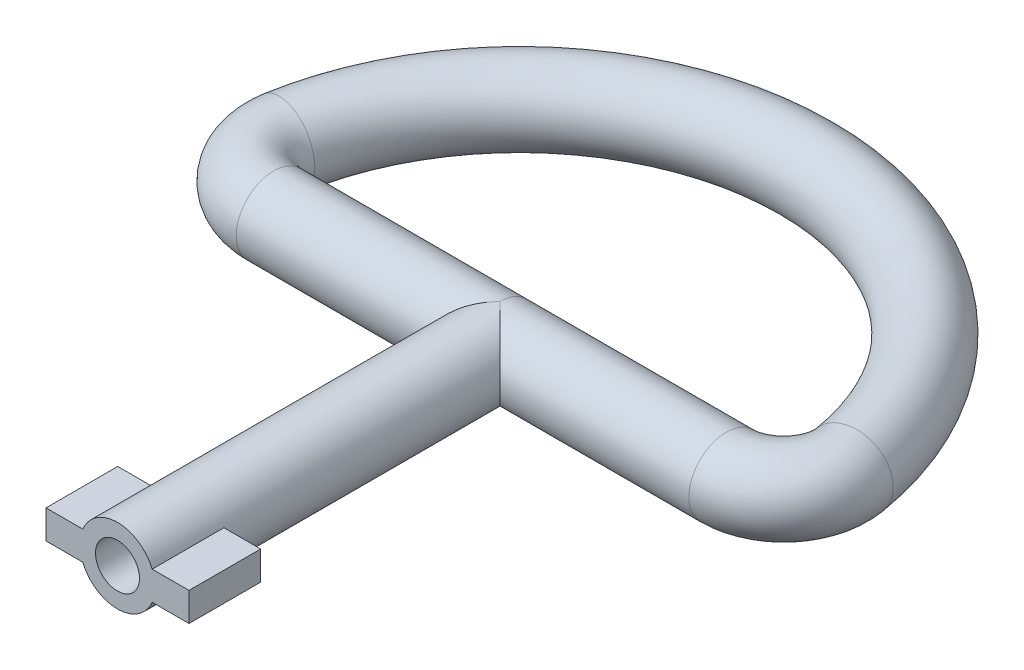
from build123d import *

# Parameters (mm, degrees)
CROQUIS1_R              = 2.3
SALIENTE_EXTRUIR1_DEPTH = 7.5
CROQUIS4_R              = 3.925
SALIENTE_EXTRUIR3_DEPTH = 32.5
CROQUIS5_R              = 3.925


with BuildPart() as part:
    # Croquis1 → Saliente-Extruir1 (new body)
    with BuildSketch(Plane.XY):
        with BuildLine():
            Line((3.627068375, 1.5), (7.475, 1.5))
            Line((7.475, 1.5), (7.475, -1.5))
            Line((7.475, -1.5), (3.627068375, -1.5))
            ThreePointArc((3.627068375, -1.5), (0, -3.925), (-3.627068375, -1.5))
            Line((-3.627068375, -1.5), (-7.475, -1.5))
            Line((-7.475, -1.5), (-7.475, 1.5))
            Line((-7.475, 1.5), (-3.627068375, 1.5))
            ThreePointArc((-3.627068375, 1.5), (0, 3.925), (3.627068375, 1.5))
        make_face()
        Circle(CROQUIS1_R, mode=Mode.SUBTRACT)
    extrude(amount=-SALIENTE_EXTRUIR1_DEPTH)

    # Croquis4 → Saliente-Extruir3 (add)
    with BuildSketch(Plane(origin=(0, 0, -7.5), x_dir=(-1, 0, 0), z_dir=(0, 0, -1))):
        with Locations(Location((0, 0, 0), (0, 0, 202.467889888))):
            Circle(CROQUIS4_R)
    extrude(amount=SALIENTE_EXTRUIR3_DEPTH)

    # Barrer2: sweep along a path in Croquis6
    with BuildLine(Plane(origin=(0, 0, 0), x_dir=(1, 0, 0), z_dir=(0, 1, 0))) as barrer2_path:
        Line((0, 40), (23.664319132, 40))
        ThreePointArc((23.664319132, 40), (28.246894827, 42.127016654), (29.580398915, 47))
        ThreePointArc((29.580398915, 47), (0, 72), (-29.580398915, 47))
        ThreePointArc((-29.580398915, 47), (-28.246894827, 42.127016654), (-23.664319132, 40))
        Line((-23.664319132, 40), (0, 40))
    # Croquis5 → Barrer2 (sweep)
    with BuildSketch(Plane(origin=(0, 0, 0), x_dir=(0, 0, -1), z_dir=(1, 0, 0))):
        with Locations((40, 0)):
            Circle(CROQUIS5_R)
    sweep(path=barrer2_path.line)


solid = part.part
